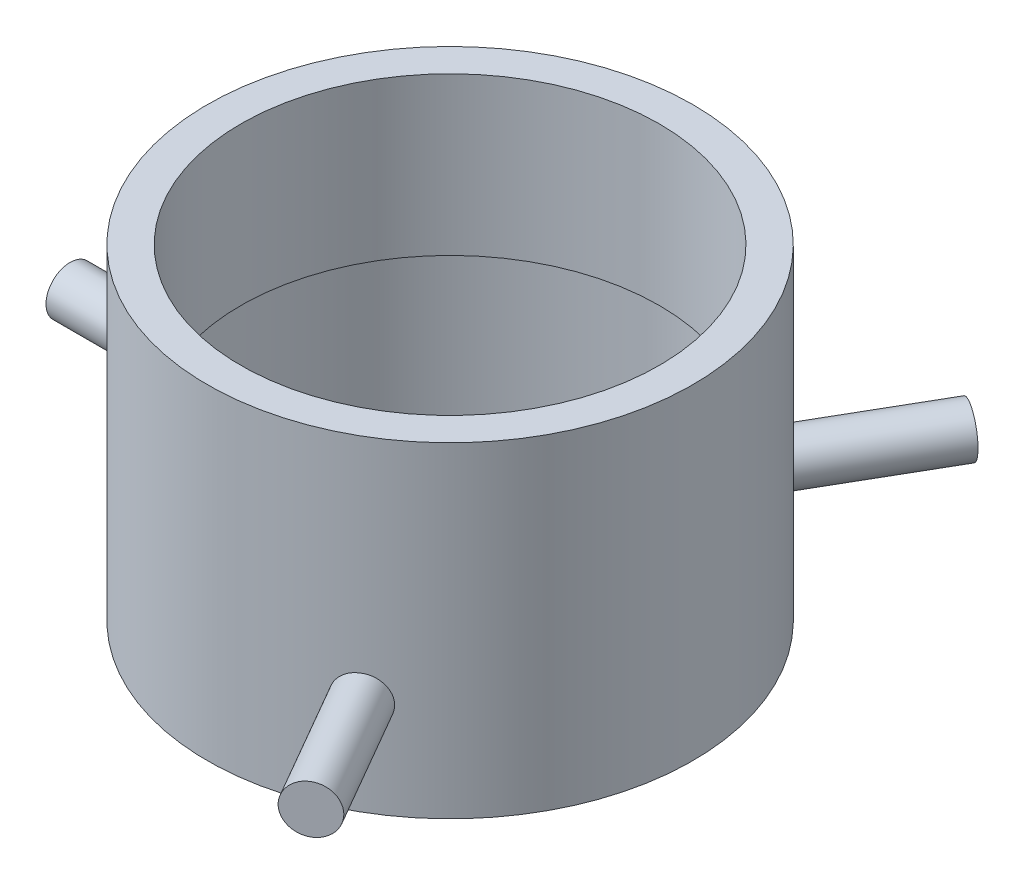
from build123d import *

# Parameters (mm, degrees)
SKETCH2_W         = 41.020252489
SKETCH2_H         = 6.35
CIRPATTERN1_COUNT = 3


with BuildPart() as part:
    # Sketch1 → Revolve1 (revolve)
    with BuildSketch(Plane.XY):
        Polygon((57.15, -44.45), (57.15, 0), (55.245, 0), (55.245, 41.529), (64.0715, 41.529), (64.0715, -44.45), align=None)
    revolve(axis=Axis((0, -1015.258156135, 0), (0, 1, 0)))


with BuildPart() as body_2:
    # Sketch2 → Revolve2 (revolve)
    with BuildSketch(Plane.XY):
        with Locations((-79.819873756, -15.875)):
            Rectangle(SKETCH2_W, SKETCH2_H)
    revolve(axis=Axis((-1132.04536123, -19.05, 0), (1, 0, 0)))


with BuildPart() as cirpattern1_1:
    # CirPattern1: pattern copy
    add(body_2.part.rotate(Axis((0, 45.82795, 0), (0, -1, 0)), 1 * 360 / CIRPATTERN1_COUNT))


with BuildPart() as cirpattern1_2:
    # CirPattern1: pattern copy
    add(body_2.part.rotate(Axis((0, 45.82795, 0), (0, -1, 0)), 2 * 360 / CIRPATTERN1_COUNT))


solid = Compound([part.part, body_2.part, cirpattern1_1.part, cirpattern1_2.part])
